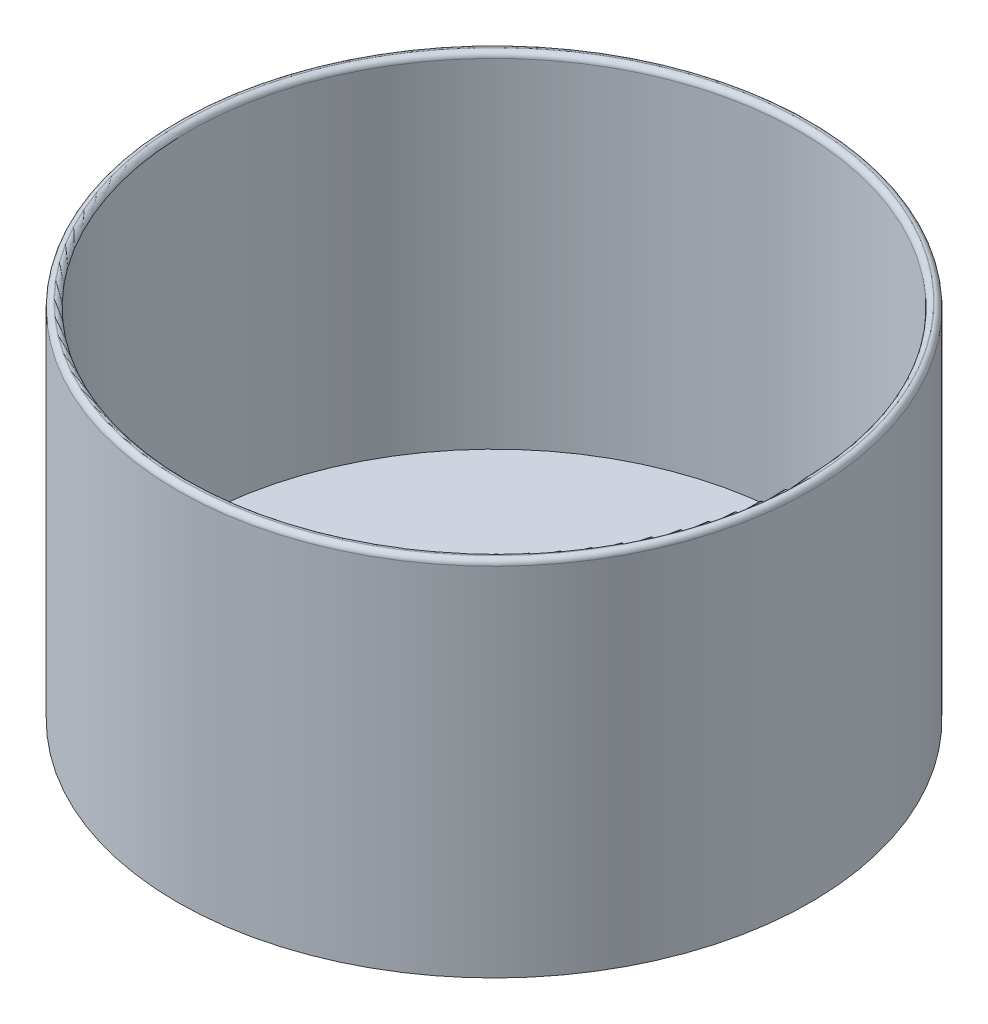
from build123d import *

# Parameters (mm, degrees)
SKETCH1_W           = 12.7
SKETCH1_H           = 12.7
BOSS_EXTRUDE1_DEPTH = 12.7
SKETCH2_R           = 88.9
BOSS_EXTRUDE2_DEPTH = 101.6
SKETCH3_R           = 85.725
CUT_EXTRUDE1_DEPTH  = 96.52
SKETCH4_W           = 12.7
SKETCH4_H           = 12.7
CUT_EXTRUDE2_DEPTH  = 12.7
FILLET2_R           = 1.524


with BuildPart() as part:
    # Sketch1 → Boss-Extrude1 (new body)
    with BuildSketch(Plane(origin=(0, 0, 0), x_dir=(1, 0, 0), z_dir=(0, 1, 0))):
        with Locations((6.35, 6.35)):
            Rectangle(SKETCH1_W, SKETCH1_H)
    extrude(amount=BOSS_EXTRUDE1_DEPTH)

    # Sketch2 → Boss-Extrude2 (add)
    with BuildSketch(Plane(origin=(0, 12.7, 0), x_dir=(1, 0, 0), z_dir=(0, 1, 0))):
        with Locations(Location((6.35, 6.35, 0), (0, 0, 270))):
            Circle(SKETCH2_R)
    extrude(amount=BOSS_EXTRUDE2_DEPTH)

    # Sketch3 → Cut-Extrude1 (cut)
    with BuildSketch(Plane(origin=(0, 114.3, 0), x_dir=(1, 0, 0), z_dir=(0, 1, 0))):
        with Locations(Location((6.35, 6.35, 0), (0, 0, 270))):
            Circle(SKETCH3_R)
    extrude(amount=-CUT_EXTRUDE1_DEPTH, mode=Mode.SUBTRACT)

    # Sketch4 → Cut-Extrude2 (cut)
    with BuildSketch(Plane.XZ):
        with Locations((6.35, -6.35)):
            Rectangle(SKETCH4_W, SKETCH4_H)
    extrude(amount=-CUT_EXTRUDE2_DEPTH, mode=Mode.SUBTRACT)

    # Fillet2
    fillet2_edges = [part.edges().sort_by_distance(p)[0] for p in [
        (6.35, 114.3, -95.25),
        (6.35, 114.3, -92.075),
    ]]
    fillet(fillet2_edges, radius=FILLET2_R)


solid = part.part
